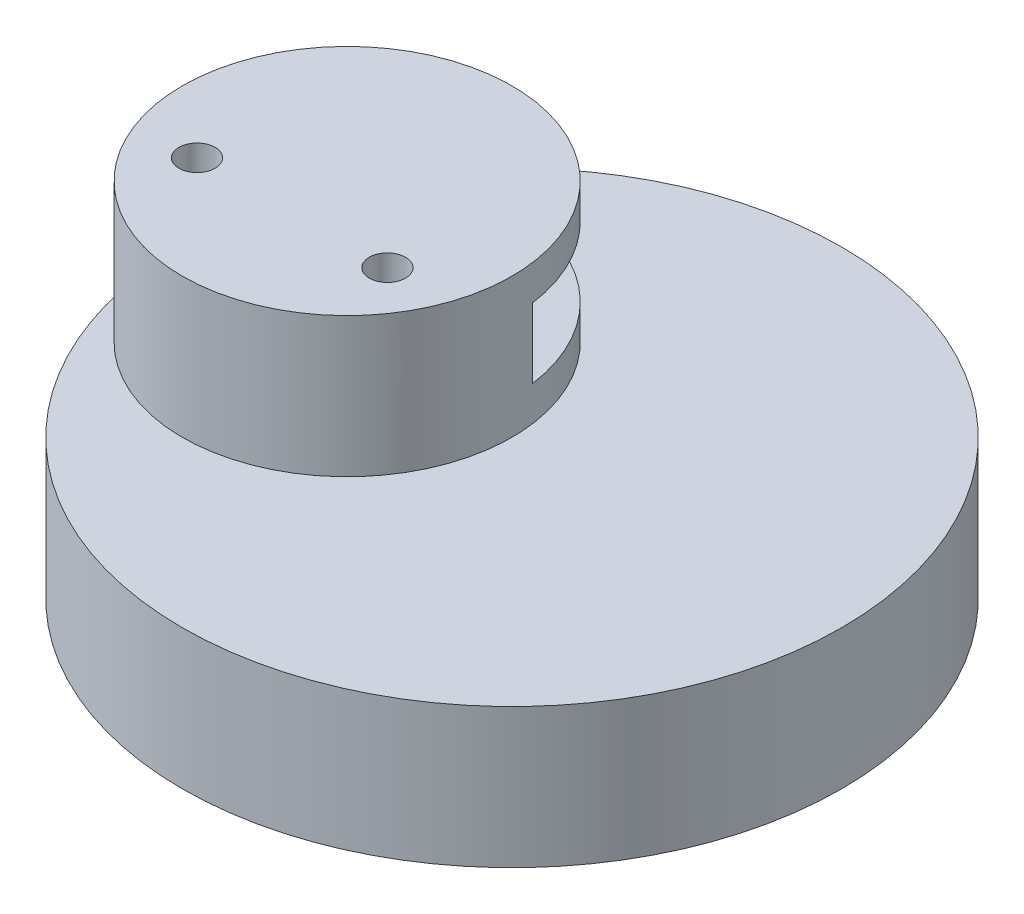
from build123d import *

# Parameters (mm, degrees)
BOSS_EXTRUDE1_DEPTH       = 12.7
SKETCH1_3_R               = 30
BOSS_EXTRUDE2_DEPTH       = 12.7
CUT_EXTRUDE1_DEPTH        = 56.554387766
CUT_EXTRUDE1_DEPTH_BACK   = 56.554387766
SKETCH2_W                 = 13
SKETCH2_H                 = 6.35
M4X0_7_TAPPED_HOLE1_D     = 3.3
M4X0_7_TAPPED_HOLE1_DEPTH = 10.1
M4X0_7_TAPPED_HOLE1_TIP   = 0.991420021
M4X0_7_TAPPED_HOLE2_D     = 3.3
M4X0_7_TAPPED_HOLE2_DEPTH = 10.1
M4X0_7_TAPPED_HOLE2_TIP   = 0.991420021


with BuildPart() as part:
    # Sketch1 → Boss-Extrude1 (new body)
    with BuildSketch(Plane(origin=(0, 0, 0), x_dir=(1, 0, 0), z_dir=(0, 1, 0))):
        with BuildLine():
            ThreePointArc((-15, -5.7e-08), (2.9e-08, -15), (15, 0))
            ThreePointArc((15, 0), (-2.9e-08, 15), (-15, -5.7e-08))
        make_face()
    extrude(amount=BOSS_EXTRUDE1_DEPTH)

    # Sketch1<3> → Boss-Extrude2 (add)
    with BuildSketch(Plane(origin=(0, 0, 0), x_dir=(1, 0, 0), z_dir=(0, 1, 0))):
        with Locations((15, 0)):
            Circle(SKETCH1_3_R)
    extrude(amount=-BOSS_EXTRUDE2_DEPTH)

    # Sketch2 → Cut-Extrude1 (cut, two sides: drawn at the far end of the back side and taken through both)
    with BuildSketch(Plane(origin=(0, 0, 0), x_dir=(0, 0, -1), z_dir=(1, 0, 0)).offset(-CUT_EXTRUDE1_DEPTH_BACK)):
        with Locations((8.5, 6.35)):
            Rectangle(SKETCH2_W, SKETCH2_H)
    extrude(amount=CUT_EXTRUDE1_DEPTH + CUT_EXTRUDE1_DEPTH_BACK, mode=Mode.SUBTRACT)

    # M4x0.7 Tapped Hole1
    with Locations(Plane(origin=(0, 12.7, 0), x_dir=(1, 0, 0), z_dir=(0, 1, 0))):
        with Locations((8.660254038, -5), (-8.660254038, -5)):
            Hole(M4X0_7_TAPPED_HOLE1_D / 2, depth=M4X0_7_TAPPED_HOLE1_DEPTH)
            with Locations((0, 0, -(M4X0_7_TAPPED_HOLE1_DEPTH + M4X0_7_TAPPED_HOLE1_TIP / 2))):  # 118° drill point
                Cone(0, M4X0_7_TAPPED_HOLE1_D / 2, M4X0_7_TAPPED_HOLE1_TIP, mode=Mode.SUBTRACT)

    # M4x0.7 Tapped Hole2
    with Locations(Plane(origin=(0, -12.7, 0), x_dir=(-1, 0, 0), z_dir=(0, -1, 0))):
        with Locations((-15, 20), (-32.320508076, -10), (2.320508076, -10)):
            Hole(M4X0_7_TAPPED_HOLE2_D / 2, depth=M4X0_7_TAPPED_HOLE2_DEPTH)
            with Locations((0, 0, -(M4X0_7_TAPPED_HOLE2_DEPTH + M4X0_7_TAPPED_HOLE2_TIP / 2))):  # 118° drill point
                Cone(0, M4X0_7_TAPPED_HOLE2_D / 2, M4X0_7_TAPPED_HOLE2_TIP, mode=Mode.SUBTRACT)


solid = part.part
